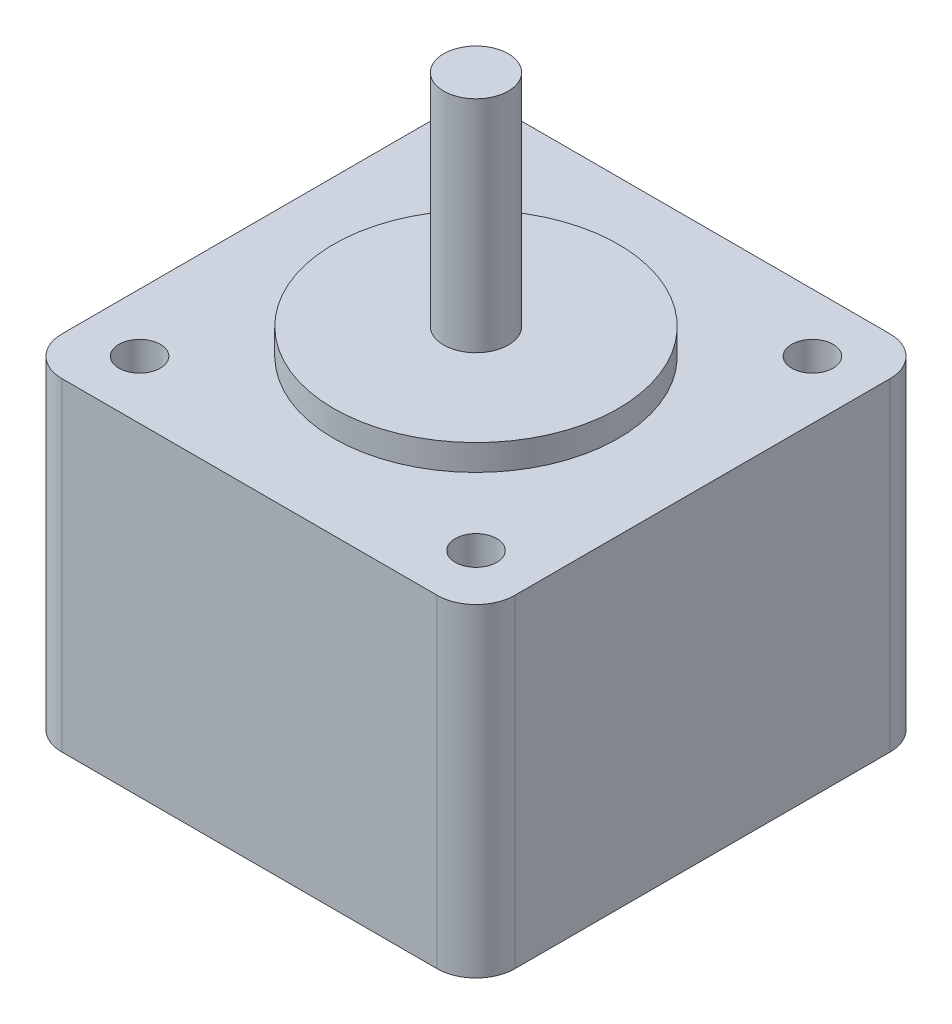
from build123d import *

# Parameters (mm, degrees)
EXTRUDE_1_DEPTH     = 25
SKETCH_2_R          = 11
EXTRUDE_2_DEPTH     = 2
SKETCH_3_R          = 2.5
EXTRUDE_3_DEPTH     = 17
SKETCH_4_R          = 1.6
CUT_EXTRUDE_1_DEPTH = 5


with BuildPart() as part:
    # 草图1 → 凸台-拉伸1 (new body)
    with BuildSketch(Plane(origin=(0, 0, 0), x_dir=(1, 0, 0), z_dir=(0, 1, 0))):
        with BuildLine():
            Line((-14.5, 17.5), (14.5, 17.5))
            ThreePointArc((14.5, 17.5), (16.621320344, 16.621320344), (17.5, 14.5))
            Line((17.5, 14.5), (17.5, -14.5))
            ThreePointArc((17.5, -14.5), (16.621320344, -16.621320344), (14.5, -17.5))
            Line((14.5, -17.5), (-14.5, -17.5))
            ThreePointArc((-14.5, -17.5), (-16.621320344, -16.621320344), (-17.5, -14.5))
            Line((-17.5, -14.5), (-17.5, 14.5))
            ThreePointArc((-17.5, 14.5), (-16.621320344, 16.621320344), (-14.5, 17.5))
        make_face()
    extrude(amount=EXTRUDE_1_DEPTH)

    # 草图2 → 凸台-拉伸2 (add)
    with BuildSketch(Plane(origin=(0, 25, 0), x_dir=(1, 0, 0), z_dir=(0, 1, 0))):
        with Locations(Location((0, 0, 0), (0, 0, 270))):
            Circle(SKETCH_2_R)
    extrude(amount=EXTRUDE_2_DEPTH)

    # 草图3 → 凸台-拉伸3 (add)
    with BuildSketch(Plane(origin=(0, 27, 0), x_dir=(1, 0, 0), z_dir=(0, 1, 0))):
        with Locations(Location((0, 0, 0), (0, 0, 270))):
            Circle(SKETCH_3_R)
    extrude(amount=EXTRUDE_3_DEPTH)

    # 草图4 → 切除-拉伸1 (cut)
    with BuildSketch(Plane(origin=(0, 25, 0), x_dir=(1, 0, 0), z_dir=(0, 1, 0))):
        with Locations(Location((-13, 13, 0), (0, 0, 270))):
            Circle(SKETCH_4_R)
        with Locations(Location((13, 13, 0), (0, 0, 270))):
            Circle(SKETCH_4_R)
        with Locations(Location((13, -13, 0), (0, 0, 270))):
            Circle(SKETCH_4_R)
        with Locations(Location((-13, -13, 0), (0, 0, 270))):
            Circle(SKETCH_4_R)
    extrude(amount=-CUT_EXTRUDE_1_DEPTH, mode=Mode.SUBTRACT)


solid = part.part
